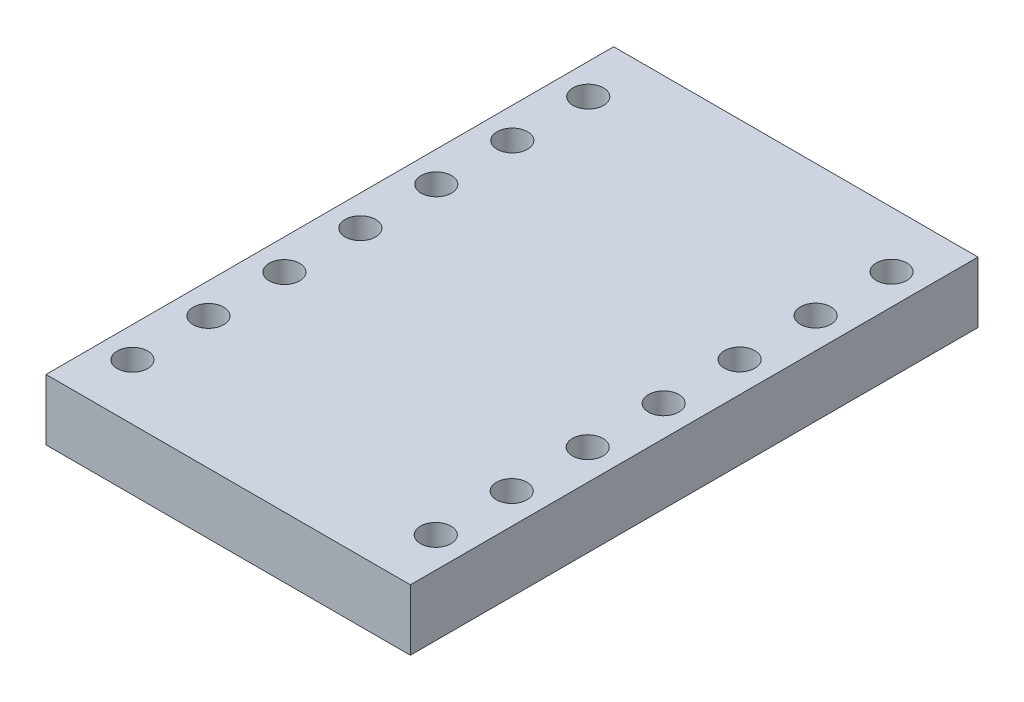
from build123d import *

# Parameters (mm, degrees)
SKETCH1_W           = 10
SKETCH1_H           = 63
BOSS_EXTRUDE1_DEPTH = 10
SKETCH2_W           = 59.69
SKETCH2_H           = 93
SKETCH2_R           = 2.5
BOSS_EXTRUDE2_DEPTH = 10
SKETCH3_R           = 2.75
CUT_EXTRUDE1_DEPTH  = 88.739238799


with BuildPart() as part:
    # Sketch1 → Boss-Extrude1 (new body)
    with BuildSketch(Plane(origin=(0, 0, 0), x_dir=(1, 0, 0), z_dir=(0, 1, 0))):
        with Locations((5, -31.5)):
            Rectangle(SKETCH1_W, SKETCH1_H)
    extrude(amount=BOSS_EXTRUDE1_DEPTH)

    # Sketch2 → Boss-Extrude2 (add)
    with BuildSketch(Plane(origin=(0, 10, 0), x_dir=(1, 0, 0), z_dir=(0, 1, 0))):
        with Locations((5, -31.5)):
            Rectangle(SKETCH2_W, SKETCH2_H)
        with Locations(Location((-19.845, 5.838000036, 0), (0, 0, 270))):
            Circle(SKETCH2_R, mode=Mode.SUBTRACT)
        with Locations(Location((-19.845, -6.607999964, 0), (0, 0, 270))):
            Circle(SKETCH2_R, mode=Mode.SUBTRACT)
        with Locations(Location((-19.845, -19.053999964, 0), (0, 0, 270))):
            Circle(SKETCH2_R, mode=Mode.SUBTRACT)
        with Locations(Location((-19.845, -31.499999964, 0), (0, 0, 270))):
            Circle(SKETCH2_R, mode=Mode.SUBTRACT)
        with Locations(Location((-19.845, -43.945999964, 0), (0, 0, 270))):
            Circle(SKETCH2_R, mode=Mode.SUBTRACT)
        with Locations(Location((-19.845, -56.391999964, 0), (0, 0, 270))):
            Circle(SKETCH2_R, mode=Mode.SUBTRACT)
        with Locations(Location((-19.845, -68.837999964, 0), (0, 0, 270))):
            Circle(SKETCH2_R, mode=Mode.SUBTRACT)
        with Locations(Location((29.845, 5.838000036, 0), (0, 0, 270))):
            Circle(SKETCH2_R, mode=Mode.SUBTRACT)
        with Locations(Location((29.845, -6.607999964, 0), (0, 0, 270))):
            Circle(SKETCH2_R, mode=Mode.SUBTRACT)
        with Locations(Location((29.845, -19.053999964, 0), (0, 0, 270))):
            Circle(SKETCH2_R, mode=Mode.SUBTRACT)
        with Locations(Location((29.845, -31.499999964, 0), (0, 0, 270))):
            Circle(SKETCH2_R, mode=Mode.SUBTRACT)
        with Locations(Location((29.845, -43.945999964, 0), (0, 0, 270))):
            Circle(SKETCH2_R, mode=Mode.SUBTRACT)
        with Locations(Location((29.845, -56.391999964, 0), (0, 0, 270))):
            Circle(SKETCH2_R, mode=Mode.SUBTRACT)
        with Locations(Location((29.845, -68.837999964, 0), (0, 0, 270))):
            Circle(SKETCH2_R, mode=Mode.SUBTRACT)
    extrude(amount=BOSS_EXTRUDE2_DEPTH)

    # Sketch3 → Cut-Extrude1 (cut, through all)
    with BuildSketch(Plane.ZY):
        with Locations((12.75, 5)):
            Circle(SKETCH3_R)
        with Locations((25.196, 5)):
            Circle(SKETCH3_R)
        with Locations((37.642, 5)):
            Circle(SKETCH3_R)
        with Locations((50.088, 5)):
            Circle(SKETCH3_R)
    extrude(amount=-CUT_EXTRUDE1_DEPTH, mode=Mode.SUBTRACT)


solid = part.part
